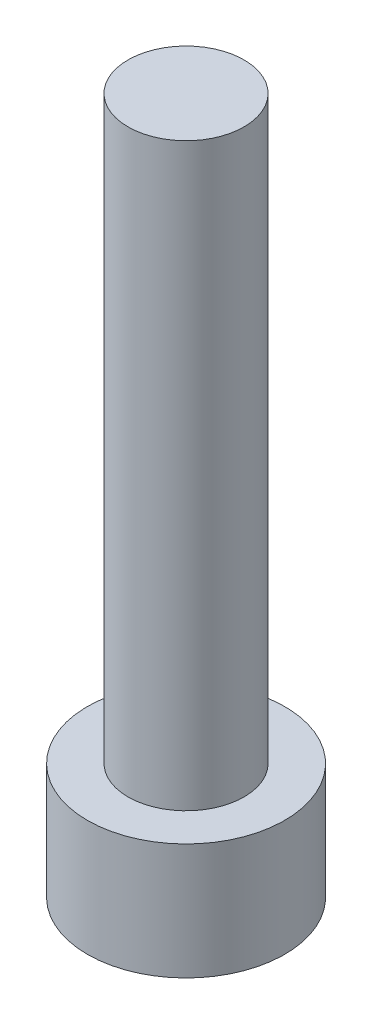
from build123d import *

# Parameters (mm, degrees)
SKETCH_1_R      = 5.1
EXTRUDE_1_DEPTH = 6
SKETCH_2_R      = 3
EXTRUDE_2_DEPTH = 30


with BuildPart() as part:
    # 草图1 → 凸台-拉伸1 (new body)
    with BuildSketch(Plane(origin=(0, 0, 0), x_dir=(1, 0, 0), z_dir=(0, 1, 0))):
        with Locations(Location((0, 0, 0), (0, 0, 270))):
            Circle(SKETCH_1_R)
    extrude(amount=EXTRUDE_1_DEPTH)

    # 草图2 → 凸台-拉伸2 (add)
    with BuildSketch(Plane(origin=(0, 6, 0), x_dir=(1, 0, 0), z_dir=(0, 1, 0))):
        with Locations(Location((0, 0, 0), (0, 0, 270))):
            Circle(SKETCH_2_R)
    extrude(amount=EXTRUDE_2_DEPTH)


solid = part.part
